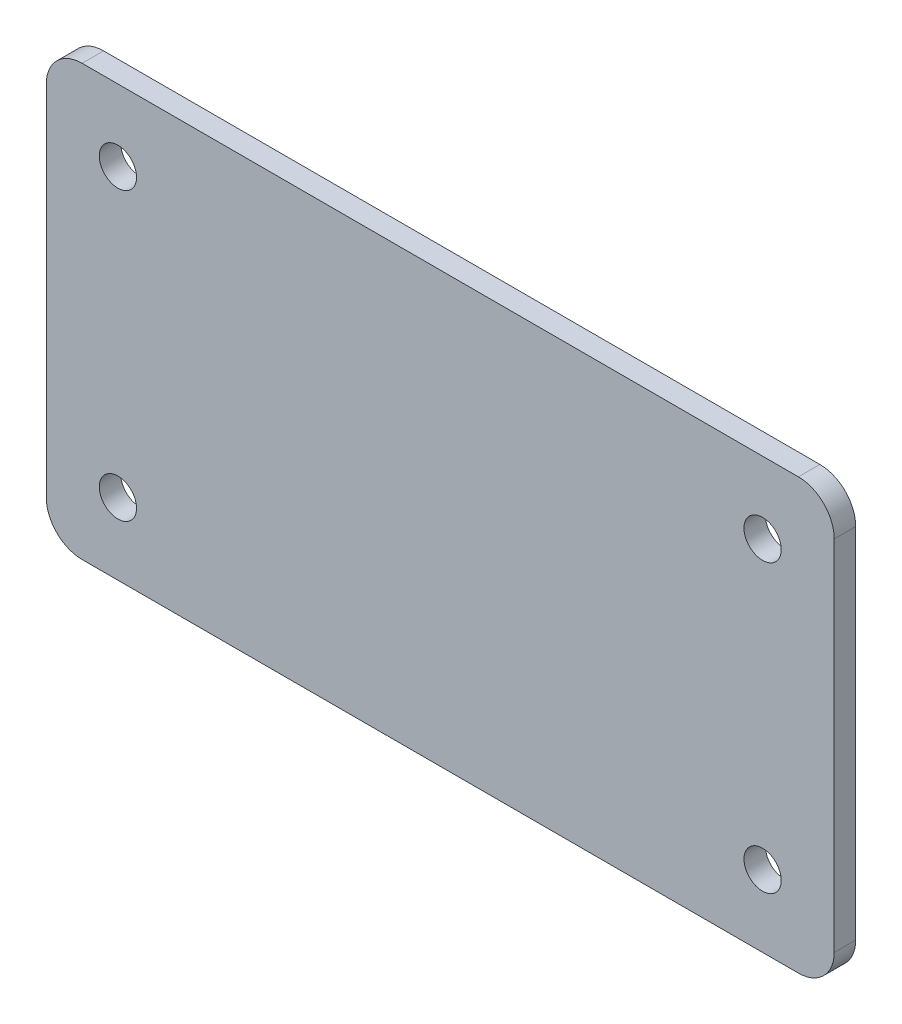
from build123d import *

# Parameters (mm, degrees)
SKETCH_2_W      = 110
SKETCH_2_H      = 60
SKETCH_2_R      = 2.6
EXTRUDE_1_DEPTH = 3
FILLET_1_R      = 5


with BuildPart() as part:
    # ｽｹｯﾁ2 → ﾎﾞｽ - 押し出し1 (new body)
    with BuildSketch(Plane.XY):
        with Locations((55, -30)):
            Rectangle(SKETCH_2_W, SKETCH_2_H)
        with Locations((10, -10)):
            Circle(SKETCH_2_R, mode=Mode.SUBTRACT)
        with Locations((100, -10)):
            Circle(SKETCH_2_R, mode=Mode.SUBTRACT)
        with Locations((10, -50)):
            Circle(SKETCH_2_R, mode=Mode.SUBTRACT)
        with Locations((100, -50)):
            Circle(SKETCH_2_R, mode=Mode.SUBTRACT)
    extrude(amount=EXTRUDE_1_DEPTH)

    # ﾌｨﾚｯﾄ1
    fillet_1_edges = [part.edges().sort_by_distance(p)[0] for p in [
        (0, 0, 1.5),
        (110, 0, 1.5),
        (110, -60, 1.5),
        (0, -60, 1.5),
    ]]
    fillet(fillet_1_edges, radius=FILLET_1_R)


solid = part.part
